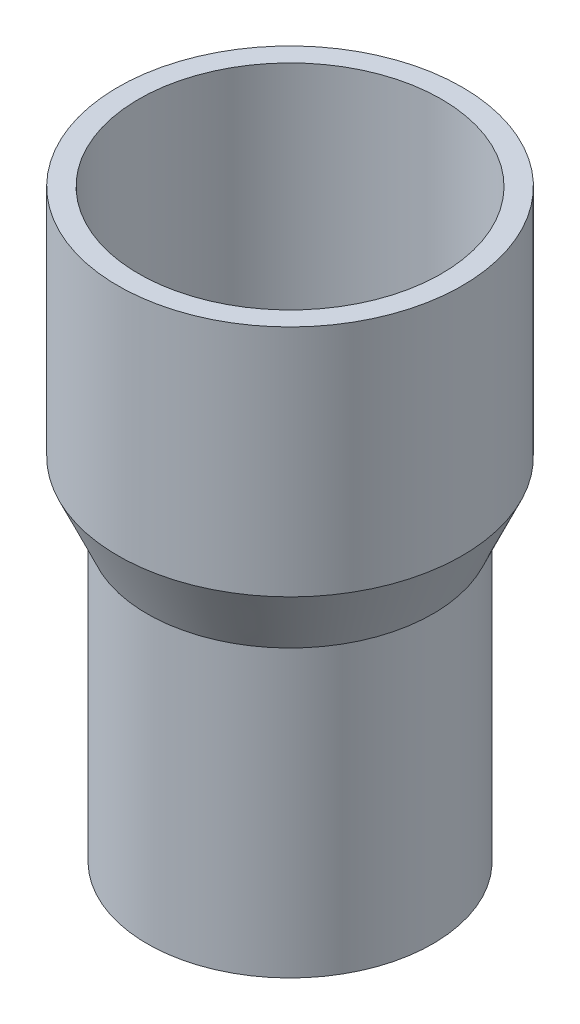
from build123d import *


with BuildPart() as part:
    # Sketch1 → Revolve1 (revolve)
    with BuildSketch(Plane.XY, mode=Mode.PRIVATE) as revolve1_sk:
        Polygon((-9.4, 0), (-11, 0), (-11, 22), (-13.25, 27), (-13.25, 45), (-11.65, 45), (-11.65, 27.343415502), (-9.4, 22.343415502), align=None)
    revolve(revolve1_sk.sketch.rotate(Axis((0, 0, 0), (0, 1, 0)), 270), axis=Axis((0, 0, 0), (0, 1, 0)))


solid = part.part
